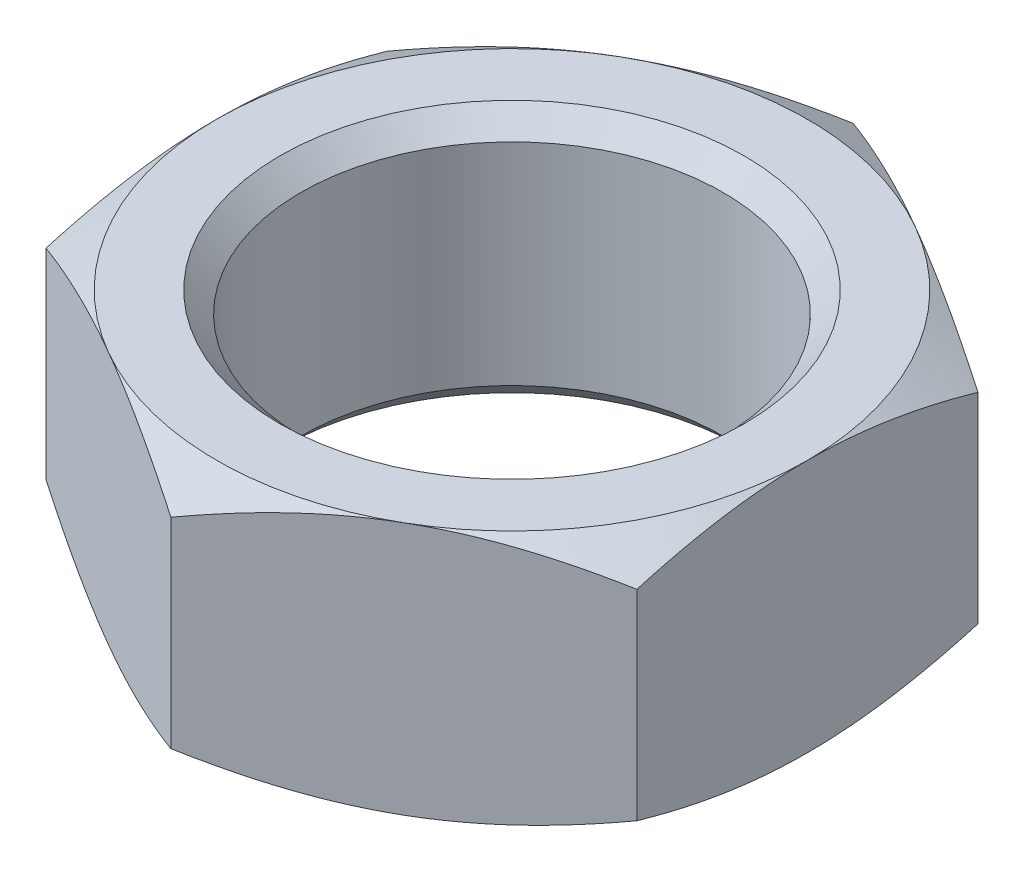
from build123d import *

# Parameters (mm, degrees)
BOSS_EXTRUDE1_DEPTH     = 6
SKETCH2_OUTSIDE_W       = 80.454
SKETCH2_OUTSIDE_H       = 84.786
SKETCH2_OUTSIDE_R       = 14
CUT_EXTRUDE1_DEPTH      = 12
CUT_EXTRUDE1_DRAFT      = -60
MIRROR1_COPY_1_SKETCH_W = 80.454
MIRROR1_COPY_1_SKETCH_H = 84.786
MIRROR1_COPY_1_SKETCH_R = 14
MIRROR1_COPY_1_DEPTH    = 12
MIRROR1_COPY_1_DRAFT    = -60
SKETCH3_R               = 10
CUT_EXTRUDE2_DEPTH      = 25.522098877
CHAMFER1_SIZE           = 1


with BuildPart() as part:
    # Sketch1 → Boss-Extrude1 (new, symmetric)
    with BuildSketch(Plane(origin=(0, 0, 0), x_dir=(1, 0, 0), z_dir=(0, 1, 0))):
        Polygon((14, -8.082903769), (14, 8.082903769), (0, 16.165807537), (-14, 8.082903769), (-14, -8.082903769), (0, -16.165807537), align=None)
    extrude(amount=BOSS_EXTRUDE1_DEPTH, both=True)


with BuildPart() as cut_extrude1_tool:
    # Sketch2 outside → Cut-Extrude1 (with draft: the straight prism first)
    with BuildSketch(Plane(origin=(0, 6, 0), x_dir=(1, 0, 0), z_dir=(0, 1, 0))):
        Rectangle(SKETCH2_OUTSIDE_W, SKETCH2_OUTSIDE_H)
        Circle(SKETCH2_OUTSIDE_R, mode=Mode.SUBTRACT)
    extrude(amount=-CUT_EXTRUDE1_DEPTH)
    # Cut-Extrude1: the draft: its side faces are tilted about the plane it starts from
    cut_extrude1_sides = [cut_extrude1_tool.faces().sort_by_distance(p)[0] for p in [
        (0, 0, 42.393),
        (40.227, 0, 0),
        (0, 0, -42.393),
        (-40.227, 0, 0),
        (-14, 0, 0),
    ]]
    draft(cut_extrude1_sides, Plane(origin=(0, 6, 0), x_dir=(1, 0, 0), z_dir=(0, 1, 0)), CUT_EXTRUDE1_DRAFT)


with BuildPart() as part_1:
    add(part.part)

    # Cut-Extrude1: cut by cut_extrude1_tool
    add(cut_extrude1_tool.part, mode=Mode.SUBTRACT)


with BuildPart() as mirror1_copy_1_tool:
    # Mirror1 copy 1 sketch → Mirror1 copy 1 (with draft: the straight prism first)
    with BuildSketch(Plane.XZ.offset(6)):
        Rectangle(MIRROR1_COPY_1_SKETCH_W, MIRROR1_COPY_1_SKETCH_H)
        Circle(MIRROR1_COPY_1_SKETCH_R, mode=Mode.SUBTRACT)
    extrude(amount=-MIRROR1_COPY_1_DEPTH)
    # Mirror1 copy 1: the draft: its side faces are tilted about the plane it starts from
    mirror1_copy_1_sides = [mirror1_copy_1_tool.faces().sort_by_distance(p)[0] for p in [
        (0, 0, 42.393),
        (40.227, 0, 0),
        (0, 0, -42.393),
        (-40.227, 0, 0),
        (-14, 0, 0),
    ]]
    draft(mirror1_copy_1_sides, Plane.XZ.offset(6), MIRROR1_COPY_1_DRAFT)


with BuildPart() as part_2:
    add(part_1.part)

    # Mirror1 copy 1: cut by mirror1_copy_1_tool
    add(mirror1_copy_1_tool.part, mode=Mode.SUBTRACT)

    # Sketch3 → Cut-Extrude2 (cut, through all)
    with BuildSketch(Plane(origin=(0, 6, 0), x_dir=(1, 0, 0), z_dir=(0, 1, 0))):
        with Locations(Location((0, 0, 0), (0, 0, 270))):
            Circle(SKETCH3_R)
    extrude(amount=-CUT_EXTRUDE2_DEPTH, mode=Mode.SUBTRACT)

    # Chamfer1
    chamfer1_edges = [part_2.edges().sort_by_distance(p)[0] for p in [
        (0, -6, -10),
        (0, 6, -10),
    ]]
    chamfer(chamfer1_edges, length=CHAMFER1_SIZE)


solid = part_2.part
